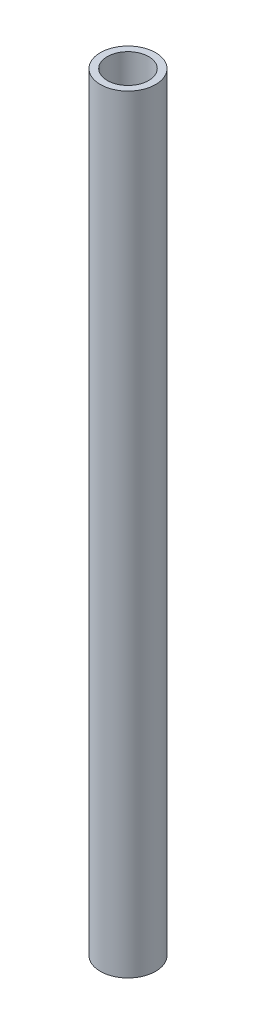
from build123d import *

# Parameters (mm, degrees)
SKETCH1_R                        = 0.5
BOSS_EXTRUDE1_DEPTH              = 13.9
F_0_4_0_4_DIAMETER_HOLE1_D       = 0.4
F_0_75_0_75_DIAMETER_HOLE2_D     = 0.75
F_0_75_0_75_DIAMETER_HOLE2_DEPTH = 11.325
F_0_75_0_75_DIAMETER_HOLE2_TIP   = 0.225322732
F_0_6_0_6_DIAMETER_HOLE4_D       = 0.6
F_0_6_0_6_DIAMETER_HOLE4_DEPTH   = 2.425
F_0_6_0_6_DIAMETER_HOLE4_TIP     = 0.180258186


with BuildPart() as part:
    # Sketch1 → Boss-Extrude1 (new body)
    with BuildSketch(Plane(origin=(0, 0, 0), x_dir=(1, 0, 0), z_dir=(0, 1, 0))):
        with Locations(Location((0, 0, 0), (0, 0, 270))):
            Circle(SKETCH1_R)
    extrude(amount=BOSS_EXTRUDE1_DEPTH)

    # Ø0.4 (0.4) Diameter Hole1 (through all)
    with Locations(Plane(origin=(0, 13.9, 0), x_dir=(-1, 0, 0), z_dir=(0, 1, 0))):
        with Locations((0, 0)):
            Hole(F_0_4_0_4_DIAMETER_HOLE1_D / 2)

    # Ø0.75 (0.75) Diameter Hole2
    with Locations(Plane(origin=(0, 13.9, 0), x_dir=(-1, 0, 0), z_dir=(0, 1, 0))):
        with Locations((0, 0)):
            Hole(F_0_75_0_75_DIAMETER_HOLE2_D / 2, depth=F_0_75_0_75_DIAMETER_HOLE2_DEPTH)
            with Locations((0, 0, -(F_0_75_0_75_DIAMETER_HOLE2_DEPTH + F_0_75_0_75_DIAMETER_HOLE2_TIP / 2))):  # 118° drill point
                Cone(0, F_0_75_0_75_DIAMETER_HOLE2_D / 2, F_0_75_0_75_DIAMETER_HOLE2_TIP, mode=Mode.SUBTRACT)

    # Ø0.6 (0.6) Diameter Hole4
    with Locations(Plane.XZ):
        with Locations((0, 0)):
            Hole(F_0_6_0_6_DIAMETER_HOLE4_D / 2, depth=F_0_6_0_6_DIAMETER_HOLE4_DEPTH)
            with Locations((0, 0, -(F_0_6_0_6_DIAMETER_HOLE4_DEPTH + F_0_6_0_6_DIAMETER_HOLE4_TIP / 2))):  # 118° drill point
                Cone(0, F_0_6_0_6_DIAMETER_HOLE4_D / 2, F_0_6_0_6_DIAMETER_HOLE4_TIP, mode=Mode.SUBTRACT)


solid = part.part
